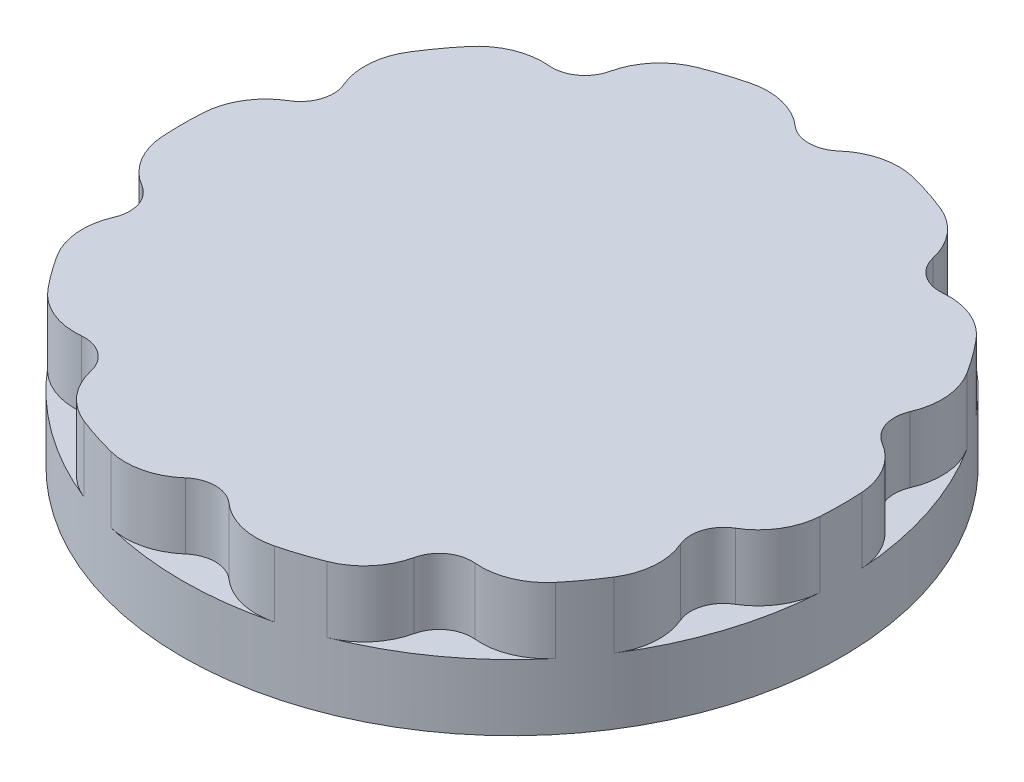
from build123d import *

# Parameters (mm, degrees)
SKETCH1_R           = 10
BOSS_EXTRUDE1_DEPTH = 4
SKETCH2_R           = 1
CUT_EXTRUDE1_DEPTH  = 2
FILLET1_R           = 2


with BuildPart() as part:
    # Sketch1 → Boss-Extrude1 (new body)
    with BuildSketch(Plane(origin=(0, 0, 0), x_dir=(1, 0, 0), z_dir=(0, 1, 0))):
        with Locations(Location((0, 0, 0), (0, 0, 270))):
            Circle(SKETCH1_R)
    extrude(amount=BOSS_EXTRUDE1_DEPTH)

    # Sketch2 → Cut-Extrude1 (cut)
    with BuildSketch(Plane(origin=(0, 4, 0), x_dir=(1, 0, 0), z_dir=(0, 1, 0))):
        with Locations((0, -10)):
            Circle(SKETCH2_R)
        with Locations((-5.877852523, -8.090169944)):
            Circle(SKETCH2_R)
        with Locations((-9.510565163, -3.090169944)):
            Circle(SKETCH2_R)
        with Locations((-9.510565163, 3.090169944)):
            Circle(SKETCH2_R)
        with Locations((-5.877852523, 8.090169944)):
            Circle(SKETCH2_R)
        with Locations((0, 10)):
            Circle(SKETCH2_R)
        with Locations((5.877852523, 8.090169944)):
            Circle(SKETCH2_R)
        with Locations((9.510565163, 3.090169944)):
            Circle(SKETCH2_R)
        with Locations((9.510565163, -3.090169944)):
            Circle(SKETCH2_R)
        with Locations((5.877852523, -8.090169944)):
            Circle(SKETCH2_R)
    extrude(amount=-CUT_EXTRUDE1_DEPTH, mode=Mode.SUBTRACT)

    # Fillet1
    fillet1_edges = [part.edges().sort_by_distance(p)[0] for p in [
        (-6.656468351, 3, 7.462669033),
        (-5.04045817, 3, 8.636769155),
        (-9.771642819, 3, 2.124852142),
        (-9.154381856, 3, 4.024586046),
        (-9.154381856, 3, -4.024586046),
        (-9.771642819, 3, -2.124852142),
        (-5.04045817, 3, -8.636769155),
        (-6.656468351, 3, -7.462669033),
        (0.998749218, 3, -9.95),
        (-0.998749218, 3, -9.95),
        (6.656468351, 3, -7.462669033),
        (5.04045817, 3, -8.636769155),
        (9.771642819, 3, -2.124852142),
        (9.154381856, 3, -4.024586046),
        (9.154381856, 3, 4.024586046),
        (9.771642819, 3, 2.124852142),
        (5.04045817, 3, 8.636769155),
        (6.656468351, 3, 7.462669033),
        (-0.998749218, 3, 9.95),
        (0.998749218, 3, 9.95),
    ]]
    fillet(fillet1_edges, radius=FILLET1_R)


solid = part.part
